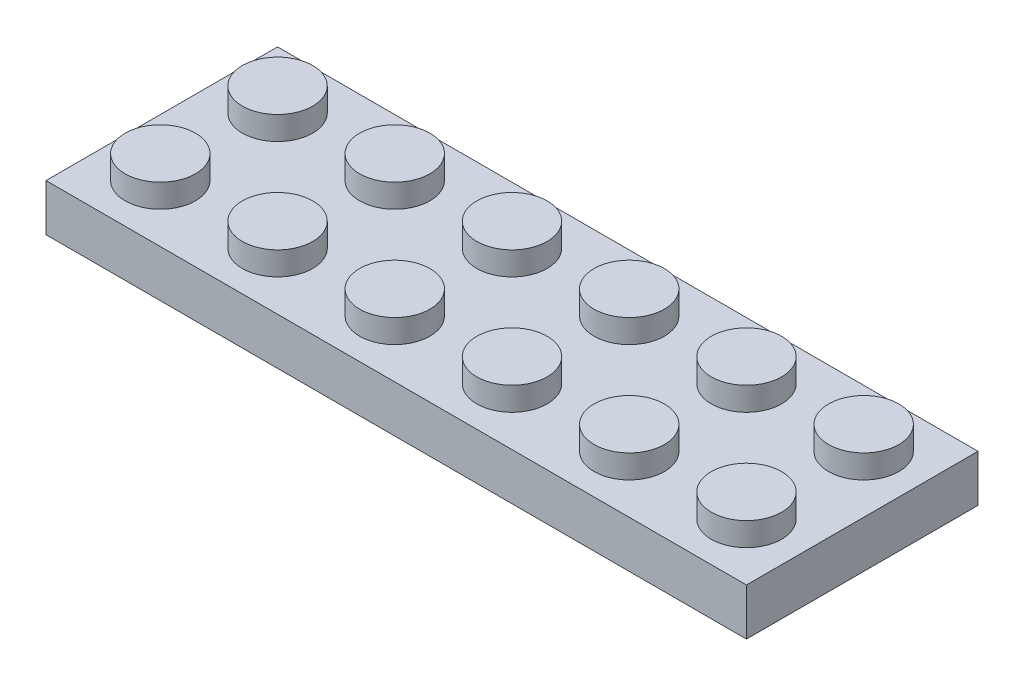
from build123d import *

# Parameters (mm, degrees)
SKETCH1_W            = 47.8
SKETCH1_H            = 3.2
BOSS_EXTRUDE1_DEPTH  = 15.8
SKETCH2_R            = 2.4
BOSS_EXTRUDE2_DEPTH  = 1.6
LPATTERN1_COUNT      = 2
LPATTERN1_PITCH      = 8
LPATTERN1_COUNT_DIR2 = 6
LPATTERN1_PITCH_DIR2 = 8
SHELL1_T             = -1.2
SKETCH4_R            = 3.25
SKETCH4_R_2          = 2.4
BOSS_EXTRUDE3_DEPTH  = 1.8
LPATTERN2_COUNT      = 5
LPATTERN2_PITCH      = 8


with BuildPart() as part:
    # Sketch1 → Boss-Extrude1 (new body)
    with BuildSketch(Plane.XY):
        with Locations((23.9, 1.6)):
            Rectangle(SKETCH1_W, SKETCH1_H)
    extrude(amount=-BOSS_EXTRUDE1_DEPTH)

    # Sketch2 → Boss-Extrude2 (add)
    with BuildSketch(Plane(origin=(0, 3.2, 0), x_dir=(1, 0, 0), z_dir=(0, 1, 0))):
        with Locations(Location((3.9, 3.9, 0), (0, 0, 270))):
            Circle(SKETCH2_R)
    boss_extrude2 = extrude(amount=BOSS_EXTRUDE2_DEPTH)

    # LPattern1: Boss-Extrude2 2 × 6
    with Locations(*[(j * LPATTERN1_PITCH_DIR2, 0, -i * LPATTERN1_PITCH) for i in range(LPATTERN1_COUNT) for j in range(LPATTERN1_COUNT_DIR2) if (i, j) != (0, 0)]):
        add(boss_extrude2)

    # Shell1
    shell1_openings = [part.faces().sort_by_distance(p)[0] for p in [
        (23.9, 0, -7.9),
    ]]
    offset(amount=SHELL1_T, openings=shell1_openings, kind=Kind.INTERSECTION)

    # Sketch4 → Boss-Extrude3 (add)
    with BuildSketch(Plane.XZ.offset(-2)):
        with Locations(Location((7.9, -7.9, 0), (0, 0, 90))):
            Circle(SKETCH4_R)
        with Locations(Location((7.9, -7.9, 0), (0, 0, 270))):
            Circle(SKETCH4_R_2, mode=Mode.SUBTRACT)
    boss_extrude3 = extrude(amount=BOSS_EXTRUDE3_DEPTH)

    # LPattern2: Boss-Extrude3 ×5
    with Locations(*[(i * LPATTERN2_PITCH, 0, 0) for i in range(1, LPATTERN2_COUNT)]):
        add(boss_extrude3)


solid = part.part
